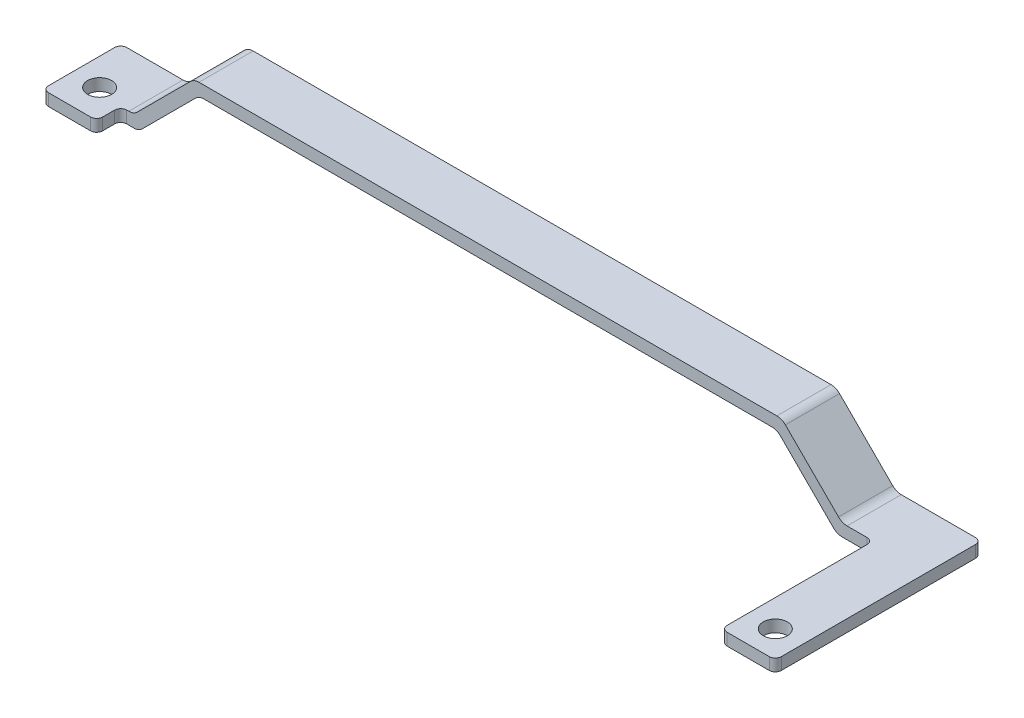
from build123d import *

# Parameters (mm, degrees)
SKETCH1_R           = 2
BOSS_EXTRUDE1_DEPTH = 12
CUT_EXTRUDE1_DEPTH  = 144.178202252
FILLET1_R           = 2


with BuildPart() as part:
    # Sketch1 → Boss-Extrude1 (new body)
    with BuildSketch(Plane(origin=(0, 0, 0), x_dir=(1, 0, 0), z_dir=(0, 1, 0))):
        with BuildLine():
            Line((5.5, 20.76), (128.5, 20.76))
            ThreePointArc((128.5, 20.76), (129.207106781, 20.467106781), (129.5, 19.76))
            Line((129.5, 19.76), (129.5, -3.5))
            ThreePointArc((129.5, -3.5), (129.792893219, -4.207106781), (130.5, -4.5))
            Line((130.5, -4.5), (137.5, -4.5))
            ThreePointArc((137.5, -4.5), (138.207106781, -4.207106781), (138.5, -3.5))
            Line((138.5, -3.5), (138.5, 28.76))
            ThreePointArc((138.5, 28.76), (138.207106781, 29.467106781), (137.5, 29.76))
            Line((137.5, 29.76), (-3.5, 29.76))
            ThreePointArc((-3.5, 29.76), (-4.207106781, 29.467106781), (-4.5, 28.76))
            Line((-4.5, 28.76), (-4.5, 17.76))
            ThreePointArc((-4.5, 17.76), (-4.207106781, 17.052893219), (-3.5, 16.76))
            Line((-3.5, 16.76), (3.5, 16.76))
            ThreePointArc((3.5, 16.76), (4.207106781, 17.052893219), (4.5, 17.76))
            Line((4.5, 17.76), (4.5, 19.76))
            ThreePointArc((4.5, 19.76), (4.792893219, 20.467106781), (5.5, 20.76))
        make_face()
        with Locations(Location((0, 21.76, 0), (0, 0, 270))):
            Circle(SKETCH1_R, mode=Mode.SUBTRACT)
        with Locations(Location((134, 0, 0), (0, 0, 270))):
            Circle(SKETCH1_R, mode=Mode.SUBTRACT)
    extrude(amount=BOSS_EXTRUDE1_DEPTH)

    # Sketch2 → Cut-Extrude1 (cut, through all)
    with BuildSketch(Plane.XY.offset(4.5)):
        Polygon((-4.5, 12), (-4.5, 2), (6.671572875, 2), (16.671572875, 12), align=None)
        Polygon((7.5, 0), (123.5, 0), (113.5, 10), (17.5, 10), align=None)
        Polygon((114.328427125, 12), (124.328427125, 2), (138.5, 2), (138.5, 12), align=None)
    extrude(amount=-CUT_EXTRUDE1_DEPTH, mode=Mode.SUBTRACT)

    # Fillet1
    fillet1_edges = [part.edges().sort_by_distance(p)[0] for p in [
        (16.671572875, 12, -25.26),
        (6.671572875, 2, -25.26),
        (7.5, 0, -25.26),
        (17.5, 10, -25.26),
        (113.5, 10, -25.26),
        (123.5, 0, -25.26),
        (124.328427125, 2, -25.26),
        (114.328427125, 12, -25.26),
    ]]
    fillet(fillet1_edges, radius=FILLET1_R)


solid = part.part
